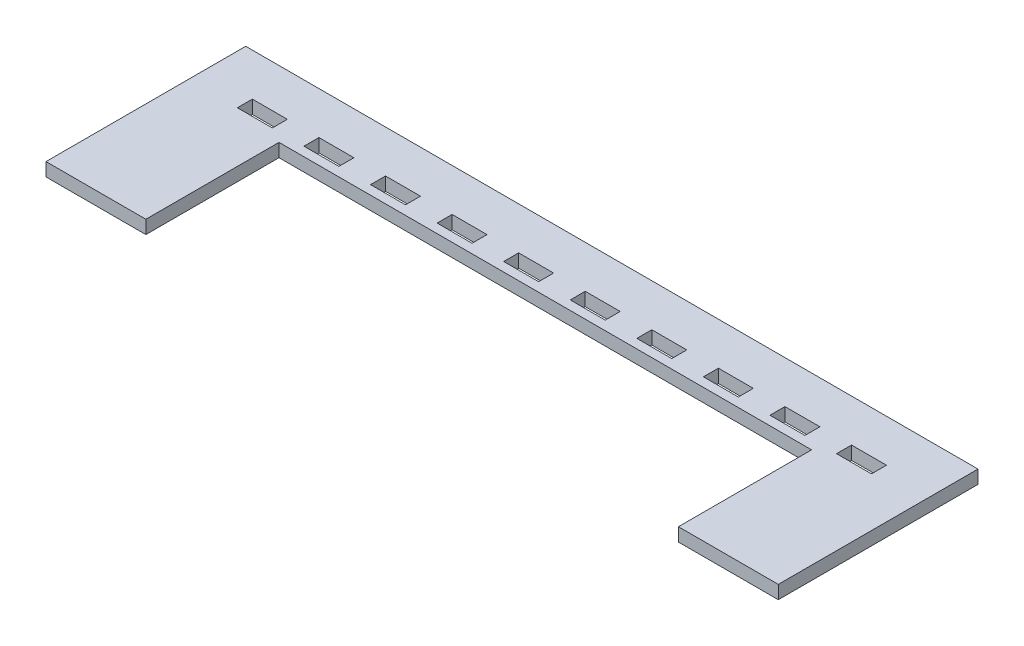
from build123d import *

# Parameters (mm, degrees)
EXTRUDE_1_DEPTH     = 4
SKETCH_2_W          = 10.5
SKETCH_2_H          = 4.5
CUT_EXTRUDE_1_DEPTH = 147.512735554


with BuildPart() as part:
    # Эскиз1 → Бобышка-Вытянуть1 (new body)
    with BuildSketch(Plane(origin=(0, 0, 0), x_dir=(1, 0, 0), z_dir=(0, 1, 0))):
        Polygon((-135, -16.788922156), (-135, -56.788922156), (-105, -56.788922156), (-105, -16.788922156), (55, -16.788922156), (55, -56.788922156), (85, -56.788922156), (85, -16.788922156), (85, 3.211077844), (-135, 3.211077844), align=None)
    extrude(amount=EXTRUDE_1_DEPTH)

    # Эскиз2 → Вырез-Вытянуть1 (cut, through all)
    with BuildSketch(Plane(origin=(0, 0, 0), x_dir=(1, 0, 0), z_dir=(0, 1, 0))):
        with Locations((-115, -11.788922156)):
            Rectangle(SKETCH_2_W, SKETCH_2_H)
        with Locations((-95, -11.788922156)):
            Rectangle(SKETCH_2_W, SKETCH_2_H)
        with Locations((-75, -11.788922156)):
            Rectangle(SKETCH_2_W, SKETCH_2_H)
        with Locations((-55, -11.788922156)):
            Rectangle(SKETCH_2_W, SKETCH_2_H)
        with Locations((-35, -11.788922156)):
            Rectangle(SKETCH_2_W, SKETCH_2_H)
        with Locations((-15, -11.788922156)):
            Rectangle(SKETCH_2_W, SKETCH_2_H)
        with Locations((5, -11.788922156)):
            Rectangle(SKETCH_2_W, SKETCH_2_H)
        with Locations((25, -11.788922156)):
            Rectangle(SKETCH_2_W, SKETCH_2_H)
        with Locations((45, -11.788922156)):
            Rectangle(SKETCH_2_W, SKETCH_2_H)
        with Locations((65, -11.788922156)):
            Rectangle(SKETCH_2_W, SKETCH_2_H)
    extrude(amount=CUT_EXTRUDE_1_DEPTH, mode=Mode.SUBTRACT)


solid = part.part
